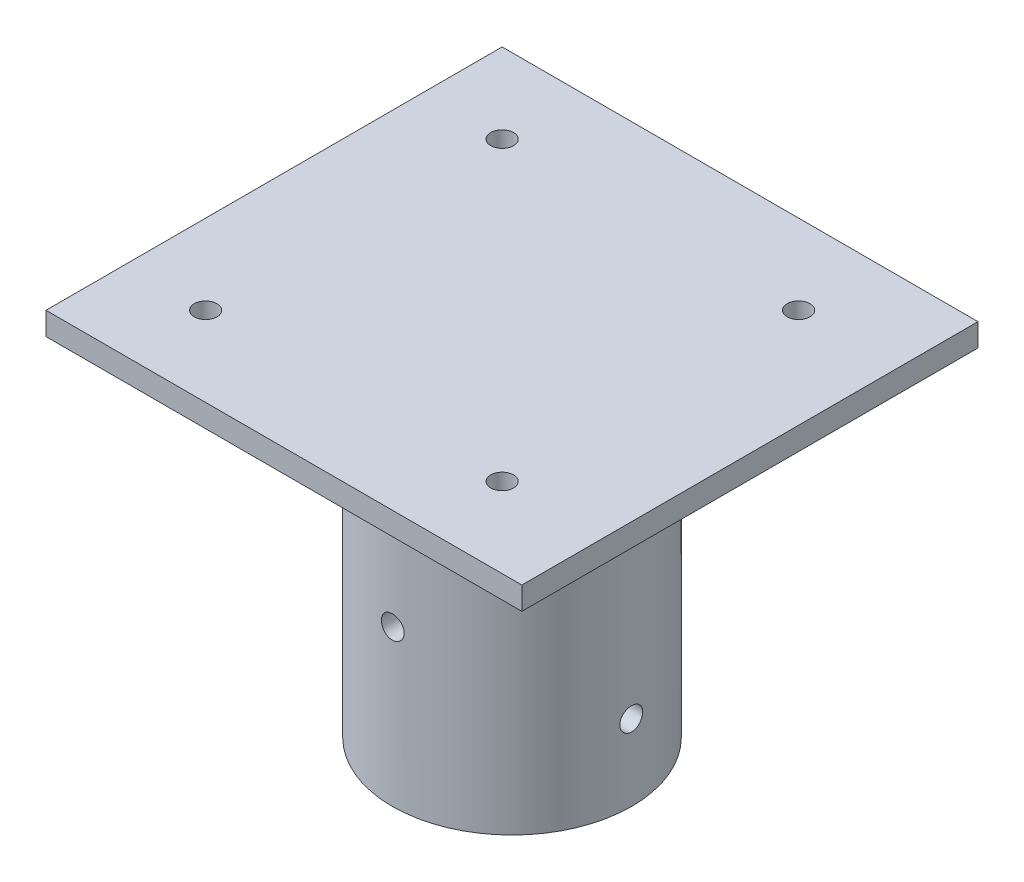
from build123d import *

# Parameters (mm, degrees)
SKETCH1_W            = 52.99786638
SKETCH1_H            = 50.8
BOSS_EXTRUDE1_DEPTH  = 2.54
SKETCH2_R            = 1.27
CUT_EXTRUDE1_DEPTH   = 37.794090017
LPATTERN1_COUNT      = 2
LPATTERN1_PITCH      = 33.02
LPATTERN1_COUNT_DIR2 = 2
LPATTERN1_PITCH_DIR2 = 33.02
SKETCH3_R            = 13.335
SKETCH3_R_2          = 9.525
BOSS_EXTRUDE2_DEPTH  = 38.1
SKETCH4_R            = 1.27
CUT_EXTRUDE2_DEPTH   = 7.62
SKETCH5_R            = 1.27
CUT_EXTRUDE3_DEPTH   = 7.62


with BuildPart() as part:
    # Sketch1 → Boss-Extrude1 (new body)
    with BuildSketch(Plane(origin=(0, 0, 0), x_dir=(1, 0, 0), z_dir=(0, 1, 0))):
        Rectangle(SKETCH1_W, SKETCH1_H)
    extrude(amount=BOSS_EXTRUDE1_DEPTH)

    # Sketch2 → Cut-Extrude1 (cut, through all)
    with BuildSketch(Plane.XZ):
        with Locations(Location((-17.60893319, 16.51, 0), (0, 0, 270))):
            Circle(SKETCH2_R)
    cut_extrude1 = extrude(amount=-CUT_EXTRUDE1_DEPTH, mode=Mode.SUBTRACT)

    # LPattern1: Cut-Extrude1 2 × 2
    with Locations(*[(i * LPATTERN1_PITCH, 0, -j * LPATTERN1_PITCH_DIR2) for i in range(LPATTERN1_COUNT) for j in range(LPATTERN1_COUNT_DIR2) if (i, j) != (0, 0)]):
        add(cut_extrude1, mode=Mode.SUBTRACT)

    # Sketch3 → Boss-Extrude2 (add)
    with BuildSketch(Plane.XZ):
        with Locations(Location((0, 0, 0), (0, 0, 90))):
            Circle(SKETCH3_R)
        with Locations(Location((0, 0, 0), (0, 0, 90))):
            Circle(SKETCH3_R_2, mode=Mode.SUBTRACT)
    extrude(amount=BOSS_EXTRUDE2_DEPTH)

    # Sketch4 → Cut-Extrude2 (cut)
    with BuildSketch(Plane.XY.offset(13.335)):
        with Locations(Location((0, -20.78376556, 0), (0, 0, 270))):
            Circle(SKETCH4_R)
    extrude(amount=-CUT_EXTRUDE2_DEPTH, mode=Mode.SUBTRACT)

    # Sketch5 → Cut-Extrude3 (cut)
    with BuildSketch(Plane(origin=(13.335, 0, 0), x_dir=(0, 0, -1), z_dir=(1, 0, 0))):
        with Locations((0, -29.639158728)):
            Circle(SKETCH5_R)
    extrude(amount=-CUT_EXTRUDE3_DEPTH, mode=Mode.SUBTRACT)


solid = part.part
